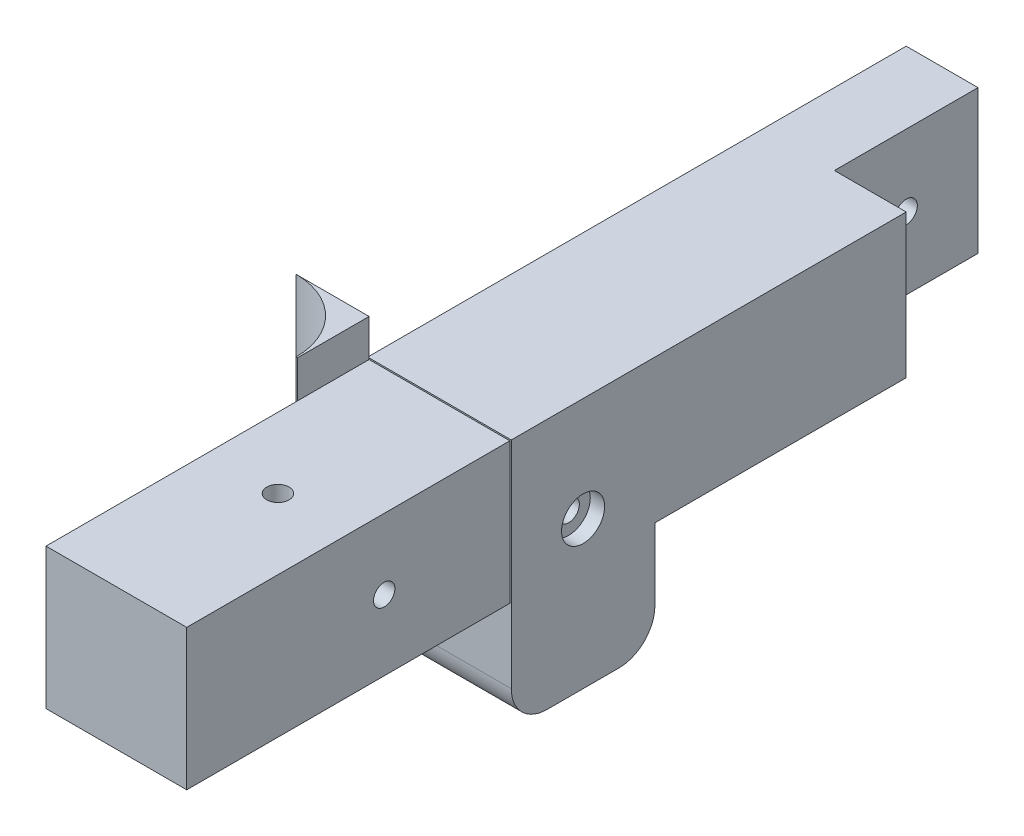
from build123d import *

# Parameters (mm, degrees)
SKETCH_1_W           = 20
SKETCH_1_H           = 20
EXTRUDE_1_DEPTH      = 120
SKETCH_2_W           = 10
SKETCH_2_H           = 20
CUT_EXTRUDE_1_DEPTH  = 120
CUT_EXTRUDE_2_DEPTH  = 120
SKETCH_4_R           = 3
CUT_EXTRUDE_3_DEPTH  = 2
SKETCH_6_R           = 1.49
CUT_EXTRUDE_4_DEPTH  = 20
CUT_EXTRUDE_5_DEPTH  = 20
SKETCH_8_W           = 19.6
SKETCH_8_H           = 0.2
SKETCH_8_W_2         = 0.2
SKETCH_8_H_2         = 19.6
CUT_EXTRUDE_6_DEPTH  = 45
EXTRUDE_2_DEPTH      = 24.8
EXTRUDE_START        = 5.2
EXTRUDE_3_DEPTH      = 5.2
SKETCH_12_W          = 20
SKETCH_12_H          = 20
EXTRUDE_4_DEPTH      = 15
SKETCH_13_W          = 5
SKETCH_13_H          = 5
SKETCH_13_H_2        = 4.5
CUT_EXTRUDE_8_DEPTH  = 15
SKETCH_14_R          = 2
CUT_EXTRUDE_9_DEPTH  = 70
SKETCH_15_W          = 10
SKETCH_15_H          = 5.5
CUT_EXTRUDE_10_DEPTH = 15
CUT_EXTRUDE_11_DEPTH = 5
CUT_EXTRUDE_12_DEPTH = 20
SKETCH_18_R          = 3
CUT_EXTRUDE_13_DEPTH = 2
SKETCH_19_W          = 0.2
SKETCH_19_H          = 25.5
CUT_EXTRUDE_14_DEPTH = 15
SKETCH_21_W          = 10.4
SKETCH_21_H          = 0.2
CUT_EXTRUDE_15_DEPTH = 15


with BuildPart() as part:
    # 草图1 → 凸台-拉伸1 (new body)
    with BuildSketch(Plane.XY):
        with Locations((10, 10)):
            Rectangle(SKETCH_1_W, SKETCH_1_H)
    extrude(amount=EXTRUDE_1_DEPTH)

    # 草图2 → 切除-拉伸1 (cut)
    with BuildSketch(Plane(origin=(0, 20, 0), x_dir=(1, 0, 0), z_dir=(0, 1, 0))):
        with Locations((15, -10)):
            Rectangle(SKETCH_2_W, SKETCH_2_H)
    extrude(amount=-CUT_EXTRUDE_1_DEPTH, mode=Mode.SUBTRACT)

    # 草图3 → 切除-拉伸2 (cut)
    with BuildSketch(Plane(origin=(10, 0, 0), x_dir=(0, 0, -1), z_dir=(1, 0, 0))):
        with BuildLine():
            ThreePointArc((-8.45, 10), (-9.40684068, 11.432013275), (-11.096015511, 11.096015511))
            Line((-11.096015511, 11.096015511), (-8.903984489, 8.903984489))
            ThreePointArc((-8.903984489, 8.903984489), (-8.567986725, 9.40684068), (-8.45, 10))
        make_face()
        with BuildLine():
            Line((-8.903984489, 8.903984489), (-11.096015511, 11.096015511))
            ThreePointArc((-11.096015511, 11.096015511), (-11.096015511, 8.903984489), (-8.903984489, 8.903984489))
        make_face()
    extrude(amount=-CUT_EXTRUDE_2_DEPTH, mode=Mode.SUBTRACT)

    # 草图4 → 切除-拉伸3 (cut)
    with BuildSketch(Plane.ZY):
        with Locations((10, 10)):
            Circle(SKETCH_4_R)
    extrude(amount=-CUT_EXTRUDE_3_DEPTH, mode=Mode.SUBTRACT)

    # 草图6 → 切除-拉伸4 (cut)
    with BuildSketch(Plane.ZY):
        with Locations((92.5, 10)):
            Circle(SKETCH_6_R)
    extrude(amount=-CUT_EXTRUDE_4_DEPTH, mode=Mode.SUBTRACT)

    # 草图7 → 切除-拉伸5 (cut)
    with BuildSketch(Plane.XZ):
        with BuildLine():
            ThreePointArc((11.55, 97.5), (10.844615988, 98.799662969), (9.370485378, 98.9164079))
            Line((9.370485378, 98.9164079), (10.629514622, 96.0835921))
            ThreePointArc((10.629514622, 96.0835921), (11.299662969, 96.655384012), (11.55, 97.5))
        make_face()
        with BuildLine():
            Line((10.629514622, 96.0835921), (9.370485378, 98.9164079))
            ThreePointArc((9.370485378, 98.9164079), (8.5835921, 96.870485378), (10.629514622, 96.0835921))
        make_face()
    extrude(amount=-CUT_EXTRUDE_5_DEPTH, mode=Mode.SUBTRACT)

    # 草图8 → 切除-拉伸6 (cut)
    with BuildSketch(Plane.XY.offset(120)):
        with Locations((10, 19.9)):
            Rectangle(SKETCH_8_W, SKETCH_8_H)
        with Locations((0.1, 19.9)):
            Rectangle(SKETCH_8_W_2, SKETCH_8_H)
        with Locations((0.1, 10)):
            Rectangle(SKETCH_8_W_2, SKETCH_8_H_2)
        with Locations((19.9, 10)):
            Rectangle(SKETCH_8_W_2, SKETCH_8_H_2)
        with Locations((19.9, 0.1)):
            Rectangle(SKETCH_8_W_2, SKETCH_8_H)
        with Locations((10, 0.1)):
            Rectangle(SKETCH_8_W, SKETCH_8_H)
        with Locations((0.1, 0.1)):
            Rectangle(SKETCH_8_W_2, SKETCH_8_H)
        with Locations((19.9, 19.9)):
            Rectangle(SKETCH_8_W_2, SKETCH_8_H)
    extrude(amount=-CUT_EXTRUDE_6_DEPTH, mode=Mode.SUBTRACT)

    # 草图9 → 凸台-拉伸2 (add)
    with BuildSketch(Plane(origin=(0, 19.8, 0), x_dir=(1, 0, 0), z_dir=(0, 1, 0))):
        with BuildLine():
            Line((0, -75), (-10, -75))
            ThreePointArc((-10, -75), (-2.928932188, -77.928932188), (0, -85))
            Line((0, -85), (0.2, -85))
            Line((0.2, -85), (0.2, -75))
            Line((0.2, -75), (0, -75))
        make_face()
    extrude(amount=-EXTRUDE_2_DEPTH)

    # 草图10 → 凸台-拉伸3 (add)
    with BuildSketch(Plane(origin=(0, 19.8, 0), x_dir=(1, 0, 0), z_dir=(0, 1, 0)).offset(EXTRUDE_START)):
        with BuildLine():
            Line((-10, -75), (0, -75))
            Line((0, -75), (0.2, -75))
            Line((0.2, -75), (0.2, -85))
            Line((0.2, -85), (0, -85))
            ThreePointArc((0, -85), (-2.928932188, -77.928932188), (-10, -75))
        make_face()
    extrude(amount=-EXTRUDE_3_DEPTH)

    # 草图12 → 凸台-拉伸4 (add)
    with BuildSketch(Plane.XZ):
        with Locations((10, 65)):
            Rectangle(SKETCH_12_W, SKETCH_12_H)
    extrude(amount=EXTRUDE_4_DEPTH)

    # 草图13 → 切除-拉伸8 (cut)
    with BuildSketch(Plane.ZY):
        Polygon((60, 10.5), (60, 0), (65, 0), (70, 0), (70, 10.5), align=None)
        with Locations((62.5, -2.5)):
            Rectangle(SKETCH_13_W, SKETCH_13_H)
        with Locations((67.5, -2.5)):
            Rectangle(SKETCH_13_W, SKETCH_13_H)
        with Locations((62.5, -7.25)):
            Rectangle(SKETCH_13_W, SKETCH_13_H_2)
        with Locations((67.5, -7.25)):
            Rectangle(SKETCH_13_W, SKETCH_13_H_2)
    extrude(amount=-CUT_EXTRUDE_8_DEPTH, mode=Mode.SUBTRACT)

    # 草图14 → 切除-拉伸9 (cut)
    with BuildSketch(Plane(origin=(0, 0, 0), x_dir=(-1, 0, 0), z_dir=(0, 0, -1))):
        with Locations((-5, 14)):
            Circle(SKETCH_14_R)
    extrude(amount=-CUT_EXTRUDE_9_DEPTH, mode=Mode.SUBTRACT)

    # 草图15 → 切除-拉伸10 (cut)
    with BuildSketch(Plane.ZY):
        with Locations((65, 13.25)):
            Rectangle(SKETCH_15_W, SKETCH_15_H)
    extrude(amount=-CUT_EXTRUDE_10_DEPTH, mode=Mode.SUBTRACT)

    # 草图16 → 切除-拉伸11 (cut)
    with BuildSketch(Plane.ZY.offset(-15)):
        with BuildLine():
            ThreePointArc((66.48, 5.5), (65, 6.98), (63.52, 5.5))
            Line((63.52, 5.5), (65, 5.5))
            Line((65, 5.5), (65, 4.02))
            ThreePointArc((65, 4.02), (66.046518036, 4.453481964), (66.48, 5.5))
        make_face()
        with BuildLine():
            Line((65, 5.5), (63.52, 5.5))
            ThreePointArc((63.52, 5.5), (63.953481964, 4.453481964), (65, 4.02))
            Line((65, 4.02), (65, 5.5))
        make_face()
    extrude(amount=-CUT_EXTRUDE_11_DEPTH, mode=Mode.SUBTRACT)

    # 草图17 → 切除-拉伸12 (cut)
    with BuildSketch(Plane.ZY):
        with BuildLine():
            Line((55, -10), (55, -15))
            Line((55, -15), (60, -15))
            ThreePointArc((60, -15), (56.464466094, -13.535533906), (55, -10))
        make_face()
        with BuildLine():
            ThreePointArc((75, -10), (73.535533906, -13.535533906), (70, -15))
            Line((70, -15), (75, -15))
            Line((75, -15), (75, -10))
        make_face()
    extrude(amount=-CUT_EXTRUDE_12_DEPTH, mode=Mode.SUBTRACT)

    # 草图18 → 切除-拉伸13 (cut)
    with BuildSketch(Plane(origin=(20, 0, 0), x_dir=(0, 0, -1), z_dir=(1, 0, 0))):
        with Locations((-65, 5.5)):
            Circle(SKETCH_18_R)
    extrude(amount=-CUT_EXTRUDE_13_DEPTH, mode=Mode.SUBTRACT)

    # 草图19 → 切除-拉伸14 (cut)
    with BuildSketch(Plane.ZY):
        with Locations((70.1, 3.25)):
            Rectangle(SKETCH_19_W, SKETCH_19_H)
        with Locations((59.9, 3.25)):
            Rectangle(SKETCH_19_W, SKETCH_19_H)
    extrude(amount=-CUT_EXTRUDE_14_DEPTH, mode=Mode.SUBTRACT)

    # 草图21 → 切除-拉伸15 (cut)
    with BuildSketch(Plane.ZY):
        with Locations((65, -9.6)):
            Rectangle(SKETCH_21_W, SKETCH_21_H)
    extrude(amount=-CUT_EXTRUDE_15_DEPTH, mode=Mode.SUBTRACT)


solid = part.part
